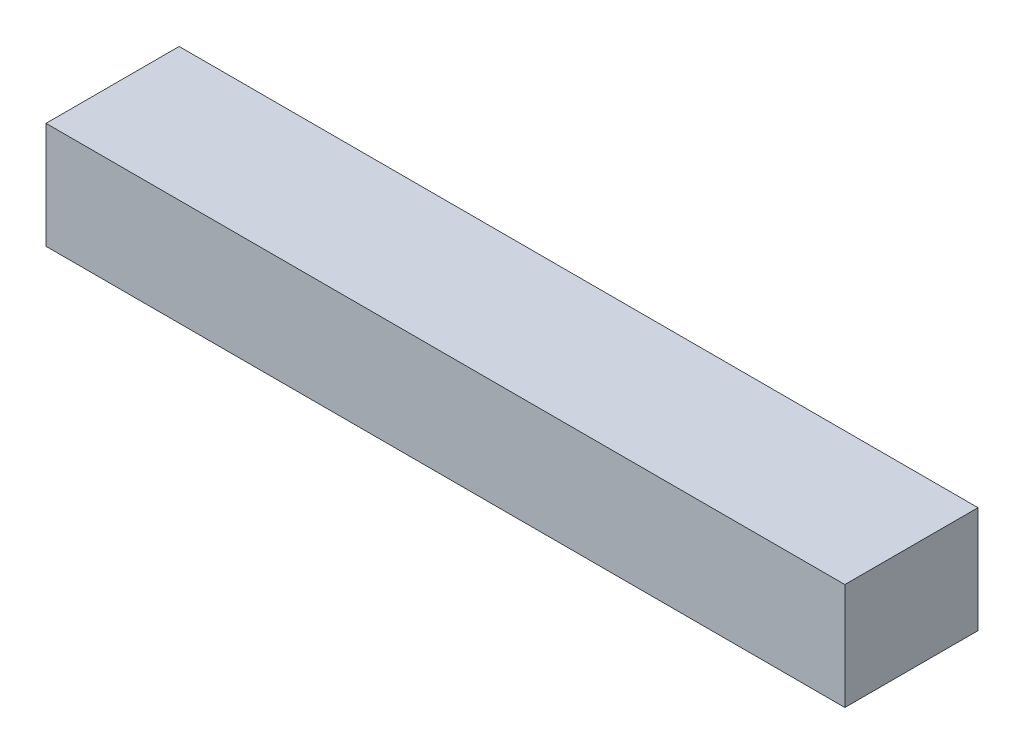
from build123d import *

# Parameters (mm, degrees)
CROQUIS1_W              = 3000
CROQUIS1_H              = 400
SALIENTE_EXTRUIR1_DEPTH = 500
CROQUIS2_R              = 101.6
SALIENTE_EXTRUIR2_DEPTH = 20


with BuildPart() as part:
    # Croquis1 → Saliente-Extruir1 (new body)
    with BuildSketch(Plane.XY):
        with Locations((1500, -200)):
            Rectangle(CROQUIS1_W, CROQUIS1_H)
    extrude(amount=SALIENTE_EXTRUIR1_DEPTH)

    # Croquis2 → Saliente-Extruir2 (add)
    with BuildSketch(Plane.XZ.offset(400)):
        with Locations(Location((2500, 250, 0), (0, 0, 90))):
            Circle(CROQUIS2_R)
        with Locations(Location((500, 250, 0), (0, 0, 90))):
            Circle(CROQUIS2_R)
        with Locations(Location((1500, 250, 0), (0, 0, 90))):
            Circle(CROQUIS2_R)
    extrude(amount=SALIENTE_EXTRUIR2_DEPTH)


solid = part.part
